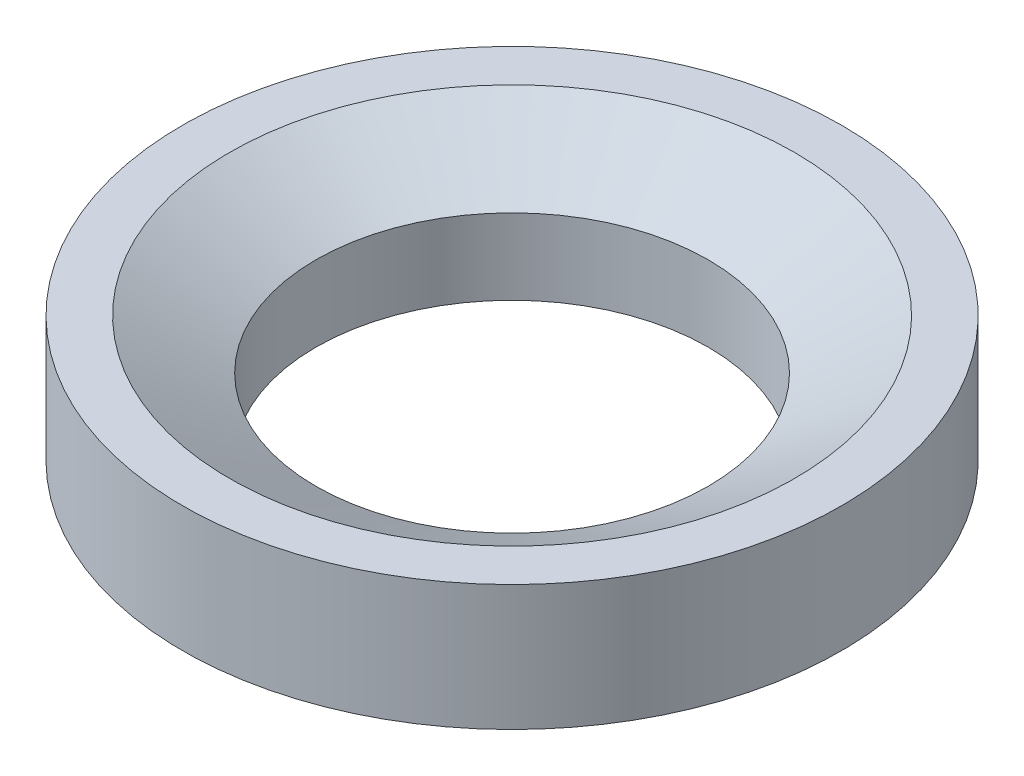
from build123d import *


with BuildPart() as part:
    # 草图2 → 旋转1 (revolve)
    with BuildSketch(Plane(origin=(0, 0, 0), x_dir=(0, 0, -1), z_dir=(1, 0, 0)), mode=Mode.PRIVATE) as revolve_1_sk:
        Polygon((-10.5, 2), (-9, 2), (-6.25, 0.41228676), (-6.25, -2), (-10.5, -2), align=None)
    revolve(revolve_1_sk.sketch.rotate(Axis((0, -2, 0), (0, 1, 0)), 180), axis=Axis((0, -2, 0), (0, 1, 0)))


solid = part.part
